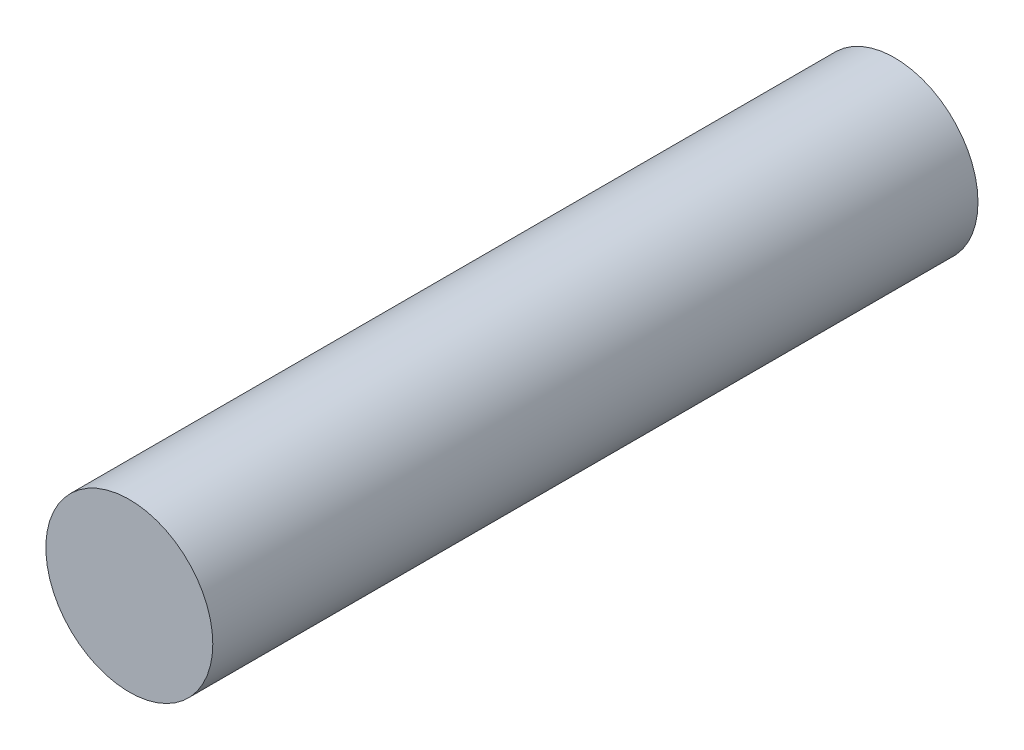
from build123d import *

# Parameters (mm, degrees)
SKETCH1_R           = 6
BOSS_EXTRUDE1_DEPTH = 55


with BuildPart() as part:
    # Sketch1 → Boss-Extrude1 (new body)
    with BuildSketch(Plane.XY):
        Circle(SKETCH1_R)
    extrude(amount=BOSS_EXTRUDE1_DEPTH)


solid = part.part
